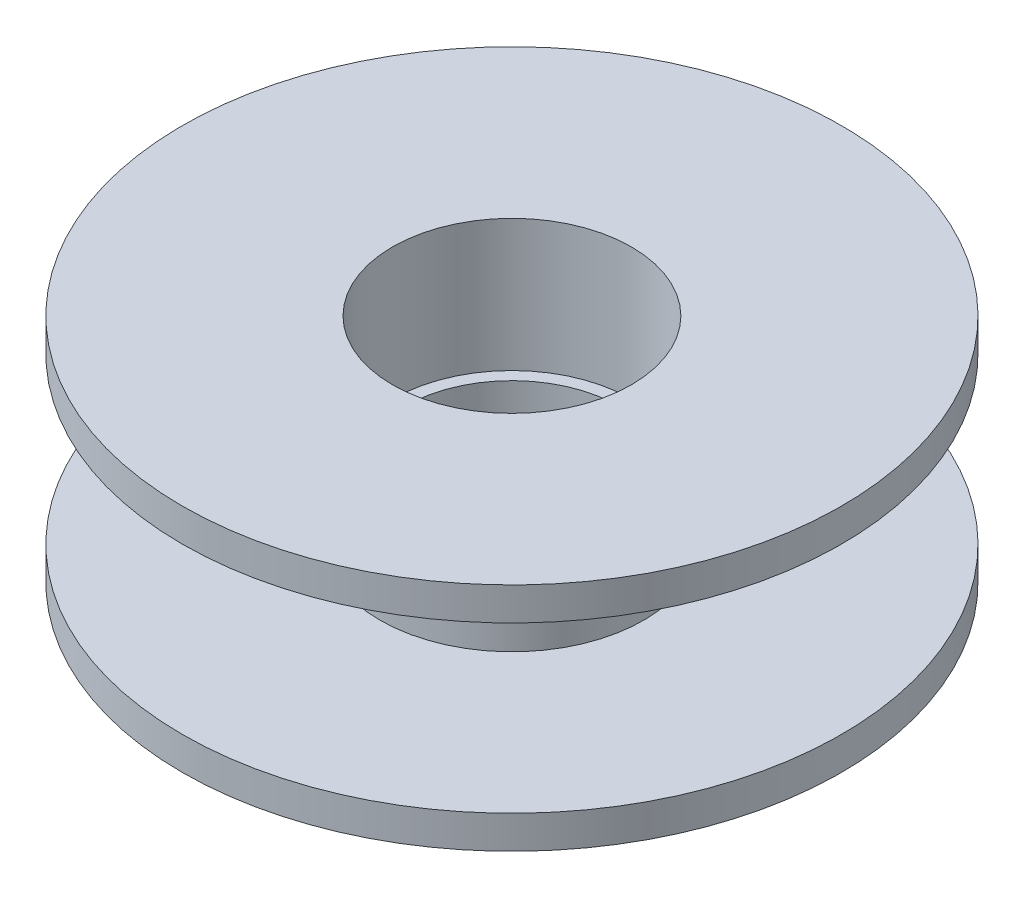
from build123d import *

# Parameters (mm, degrees)
CUT_EXTRUDE1_START = 48
SKETCH2_R          = 14.5
CUT_EXTRUDE1_DEPTH = 48


with BuildPart() as part:
    # Sketch1 → Revolve1 (revolve)
    with BuildSketch(Plane(origin=(0, 0, 0), x_dir=(0, 0, -1), z_dir=(1, 0, 0))):
        Polygon((-16, 9.838658872), (-40, 9.838658872), (-40, 5.838658872), (-13, 5.838658872), (-13, 17.838658872), (-14.5, 17.838658872), (-14.5, 29.838658872), (-16, 29.838658872), align=None)
    revolve1 = revolve(axis=Axis((0, 28.058626224, 0), (0, -1, 0)))

    # Mirror3: Revolve1 across plane
    add(revolve1.mirror(Plane.ZX.offset(19.838658872)))

    # Sketch2 → Cut-Extrude1 (cut)
    with BuildSketch(Plane(origin=(0, 17.838658872, 0), x_dir=(1, 0, 0), z_dir=(0, 1, 0)).offset(CUT_EXTRUDE1_START)):
        with Locations(Location((0, 0, 0), (0, 0, 270))):
            Circle(SKETCH2_R)
    extrude(amount=-CUT_EXTRUDE1_DEPTH, mode=Mode.SUBTRACT)


solid = part.part
